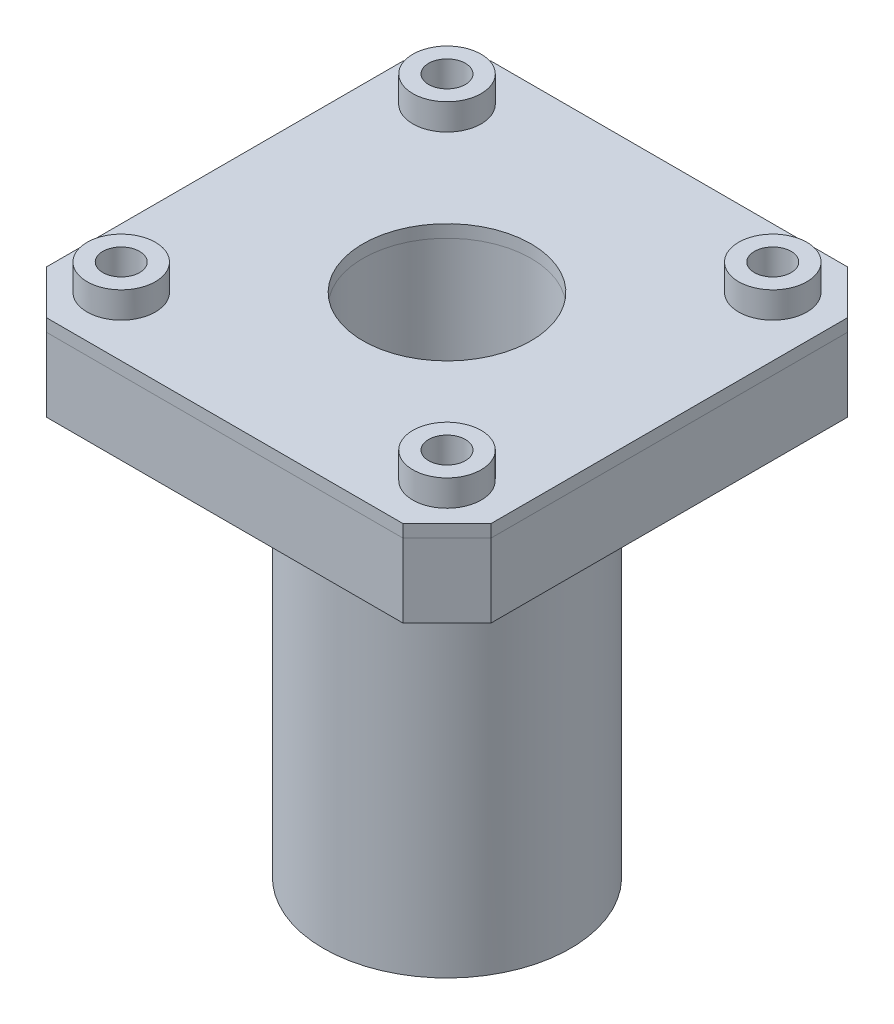
from build123d import *

# Parameters (mm, degrees)
SKETCH1_W               = 42.3
SKETCH1_H               = 42.3
BOSS_EXTRUDE1_DEPTH     = 8.2
CUT_EXTRUDE3_DEPTH      = 32.014270909
SKETCH6_R               = 3.25
BOSS_EXTRUDE2_DEPTH     = 2.5
SKETCH7_R               = 1.75
CUT_EXTRUDE6_DEPTH      = 32.766885274
SKETCH10_R              = 3
CUT_EXTRUDE9_DEPTH      = 3.25
MIRROR5_COPY_1_SKETCH_R = 3.25
MIRROR5_COPY_1_DEPTH    = 2.5
MIRROR5_COPY_2_SKETCH_R = 1.75
MIRROR5_COPY_2_DEPTH    = 32.766885274
MIRROR5_COPY_3_SKETCH_R = 3
MIRROR5_COPY_3_DEPTH    = 3.25
MIRROR5_COPY_4_SKETCH_R = 3.25
MIRROR5_COPY_4_DEPTH    = 2.5
MIRROR5_COPY_5_SKETCH_R = 1.75
MIRROR5_COPY_5_DEPTH    = 32.766885274
MIRROR5_COPY_6_SKETCH_R = 3
MIRROR5_COPY_6_DEPTH    = 3.25
SKETCH11_R              = 11.75
BOSS_EXTRUDE3_DEPTH     = 40
CUT_EXTRUDE10_START     = -1.5
CUT_EXTRUDE10_DEPTH     = 6.2
SKETCH8_R               = 8
CUT_EXTRUDE11_DEPTH     = 59.865397306


with BuildPart() as part:
    # Sketch1 → Boss-Extrude1 (new body)
    with BuildSketch(Plane(origin=(0, 0, 0), x_dir=(1, 0, 0), z_dir=(0, 1, 0))):
        Rectangle(SKETCH1_W, SKETCH1_H)
    extrude(amount=BOSS_EXTRUDE1_DEPTH)

    # Sketch4 → Cut-Extrude3 (cut, symmetric)
    with BuildSketch(Plane(origin=(0, 0, 0), x_dir=(1, 0, 0), z_dir=(0, 1, 0))):
        Polygon((-21.15, 16.963055506), (-16.963055506, 21.15), (-21.15, 21.15), align=None)
        Polygon((16.963055506, -21.15), (21.15, -16.963055506), (21.15, -21.15), align=None)
    cut_extrude3 = extrude(amount=CUT_EXTRUDE3_DEPTH, both=True, mode=Mode.SUBTRACT)

    # Mirror1: Cut-Extrude3 across plane
    add(cut_extrude3.mirror(Plane.XY), mode=Mode.SUBTRACT)

    # Sketch6 → Boss-Extrude2 (add)
    with BuildSketch(Plane(origin=(0, 8.2, 0), x_dir=(1, 0, 0), z_dir=(0, 1, 0))):
        with Locations((-15.5, 15.5)):
            Circle(SKETCH6_R)
    boss_extrude2 = extrude(amount=BOSS_EXTRUDE2_DEPTH)

    # Sketch7 → Cut-Extrude6 (cut, through all)
    with BuildSketch(Plane(origin=(0, 0, 0), x_dir=(1, 0, 0), z_dir=(0, 1, 0))):
        with Locations((-15.5, 15.5)):
            Circle(SKETCH7_R)
    cut_extrude6 = extrude(amount=CUT_EXTRUDE6_DEPTH, mode=Mode.SUBTRACT)

    # Sketch10 → Cut-Extrude9 (cut)
    with BuildSketch(Plane(origin=(0, 0, 0), x_dir=(-1, 0, 0), z_dir=(0, 1, 0))):
        with Locations((15.5, -15.5)):
            Circle(SKETCH10_R)
    cut_extrude9 = extrude(amount=CUT_EXTRUDE9_DEPTH, mode=Mode.SUBTRACT)

    # Mirror4: Boss-Extrude2, Cut-Extrude6, Cut-Extrude9 across plane
    add(boss_extrude2.mirror(Plane(origin=(0, 0, 0), x_dir=(0, 0, 1), z_dir=(1, 0, 0))))
    add(cut_extrude6.mirror(Plane(origin=(0, 0, 0), x_dir=(0, 0, 1), z_dir=(1, 0, 0))), mode=Mode.SUBTRACT)
    add(cut_extrude9.mirror(Plane(origin=(0, 0, 0), x_dir=(0, 0, 1), z_dir=(1, 0, 0))), mode=Mode.SUBTRACT)

    # Mirror5 copy 1 sketch → Mirror5 copy 1 (add)
    with BuildSketch(Plane(origin=(0, 8.2, 0), x_dir=(-1, 0, 0), z_dir=(0, 1, 0))):
        with Locations((-15.5, 15.5)):
            Circle(MIRROR5_COPY_1_SKETCH_R)
    extrude(amount=MIRROR5_COPY_1_DEPTH)

    # Mirror5 copy 2 sketch → Mirror5 copy 2 (cut, through all)
    with BuildSketch(Plane(origin=(0, 0, 0), x_dir=(-1, 0, 0), z_dir=(0, 1, 0))):
        with Locations((-15.5, 15.5)):
            Circle(MIRROR5_COPY_2_SKETCH_R)
    extrude(amount=MIRROR5_COPY_2_DEPTH, mode=Mode.SUBTRACT)

    # Mirror5 copy 3 sketch → Mirror5 copy 3 (cut)
    with BuildSketch(Plane(origin=(0, 0, 0), x_dir=(1, 0, 0), z_dir=(0, 1, 0))):
        with Locations((15.5, -15.5)):
            Circle(MIRROR5_COPY_3_SKETCH_R)
    extrude(amount=MIRROR5_COPY_3_DEPTH, mode=Mode.SUBTRACT)

    # Mirror5 copy 4 sketch → Mirror5 copy 4 (add)
    with BuildSketch(Plane(origin=(0, 8.2, 0), x_dir=(1, 0, 0), z_dir=(0, 1, 0))):
        with Locations((-15.5, -15.5)):
            Circle(MIRROR5_COPY_4_SKETCH_R)
    extrude(amount=MIRROR5_COPY_4_DEPTH)

    # Mirror5 copy 5 sketch → Mirror5 copy 5 (cut, through all)
    with BuildSketch(Plane(origin=(0, 0, 0), x_dir=(1, 0, 0), z_dir=(0, 1, 0))):
        with Locations((-15.5, -15.5)):
            Circle(MIRROR5_COPY_5_SKETCH_R)
    extrude(amount=MIRROR5_COPY_5_DEPTH, mode=Mode.SUBTRACT)

    # Mirror5 copy 6 sketch → Mirror5 copy 6 (cut)
    with BuildSketch(Plane(origin=(0, 0, 0), x_dir=(-1, 0, 0), z_dir=(0, 1, 0))):
        with Locations((15.5, 15.5)):
            Circle(MIRROR5_COPY_6_SKETCH_R)
    extrude(amount=MIRROR5_COPY_6_DEPTH, mode=Mode.SUBTRACT)

    # Sketch11 → Boss-Extrude3 (add)
    with BuildSketch(Plane.XZ):
        Circle(SKETCH11_R)
    extrude(amount=BOSS_EXTRUDE3_DEPTH)

    # Sketch2 → Cut-Extrude10 (cut)
    with BuildSketch(Plane(origin=(0, -40, 0), x_dir=(-1, 0, 0), z_dir=(0, -1, 0)).offset(CUT_EXTRUDE10_START)):
        Polygon((11.085125168, 0), (5.542562584, 9.6), (-5.542562584, 9.6), (-11.085125168, 0), (-5.542562584, -9.6), (5.542562584, -9.6), align=None)
    extrude(amount=-CUT_EXTRUDE10_DEPTH, mode=Mode.SUBTRACT)

    # Sketch8 → Cut-Extrude11 (cut, through all)
    with BuildSketch(Plane(origin=(0, -40, 0), x_dir=(1, 0, 0), z_dir=(0, 1, 0))):
        Circle(SKETCH8_R)
    extrude(amount=CUT_EXTRUDE11_DEPTH, mode=Mode.SUBTRACT)


with BuildPart() as body_2:
    # Split1: the piece on the far side of the plane
    add(part.part)
    split(bisect_by=Plane(origin=(0, 7, 0), x_dir=(0, 0, -1), z_dir=(0, -1, 0)), keep=Keep.BOTTOM)


with BuildPart() as part_1:
    add(part.part)

    # Split1
    split(bisect_by=Plane(origin=(0, 7, 0), x_dir=(0, 0, -1), z_dir=(0, -1, 0)), keep=Keep.TOP)


solid = Compound([body_2.part, part_1.part])
